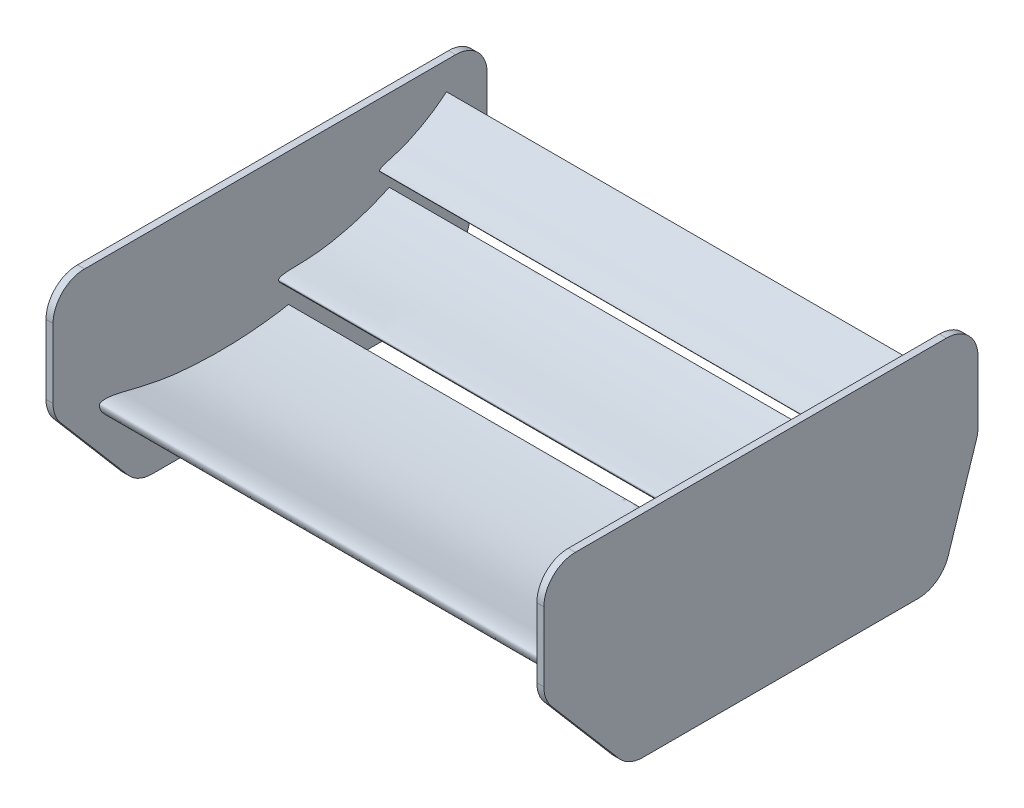
from build123d import *

# Parameters (mm, degrees)
EXTRUDED_AIRFOILS_DEPTH   = 487.449999952
EXTRUDED_AIRFOILS_2_DEPTH = 487.449999952
EXTRUDED_AIRFOILS_3_DEPTH = 487.449999952
EXTRUDED_ENDPLATE_DEPTH   = 14.200000048


with BuildPart() as part:
    # Airfoils Sketch → Extruded Airfoils (new body)
    with BuildSketch(Plane(origin=(0, 0, 0), x_dir=(0, 0, -1), z_dir=(1, 0, 0))):
        with BuildLine():
            add(Edge.make_bspline(
                [(792.439603798, 907.303291802), (792.446171081, 907.268640953), (789.682089853, 906.222334354), (787.14343716, 904.84103978), (781.389641799, 901.9239641), (774.736633883, 898.597322349), (766.183097378, 895.098479729), (756.039648025, 891.641647126), (744.265943656, 887.997719918), (731.031822052, 884.180414421), (716.523575535, 880.238338434), (700.95987565, 876.237060803), (684.557738987, 872.272309521), (667.541579637, 868.434245285), (650.131386339, 864.83621889), (632.53959645, 861.611358837), (614.975684745, 858.871428532), (597.587921503, 856.78374598), (580.457824417, 855.586248079), (563.650637288, 855.308504571), (547.226019859, 855.929399724), (531.271156892, 857.408079062), (515.877714685, 859.696840395), (501.15304031, 862.729365174), (487.202917273, 866.389194296), (474.150275032, 870.591587482), (462.117196819, 875.26177561), (451.207262735, 880.311135051), (441.512258921, 885.65102755), (433.103905877, 891.184900726), (426.042294576, 896.810376479), (420.362153479, 902.413299595), (416.0811171, 907.863991989), (413.205327734, 913.032414956), (411.811672409, 917.445296437), (411.587687822, 920.46577338), (411.818200092, 922.040378022), (412.01255513, 922.806237928), (412.207523029, 923.301301722), (412.382321348, 923.667977039), (412.534801755, 923.916187976), (412.704991729, 924.146164352), (412.915129501, 924.347486807), (413.152209092, 924.534851606), (413.510999093, 924.789777428), (414.034913369, 925.072030327), (414.870828311, 925.44116423), (415.896685237, 925.781161045), (418.59546647, 926.469892152), (423.587371889, 926.842536648), (431.449681113, 926.459382377), (441.307324477, 925.067802147), (453.214037278, 922.671568639), (467.28801474, 919.25119632), (483.628710952, 915.049329296), (502.262123688, 910.574846045), (522.977520135, 906.181321833), (545.40118948, 902.206753805), (569.035763396, 899.089476309), (593.267067222, 896.938316723), (617.538431227, 895.542126298), (641.442078996, 894.822734287), (664.614834259, 894.758673646), (686.671753534, 895.360311825), (707.235591301, 896.507587285), (725.988379628, 897.994837167), (742.709096972, 899.675118449), (757.15142712, 901.406627203), (769.34904164, 903.100156658), (778.687808405, 904.509910955), (786.263431648, 905.956734955), (789.410710987, 906.496277107), (792.432933313, 907.338487169), (792.439603798, 907.303291802)],
                knots=[0, 0, 0, 0, 0.001812691, 0.006911328, 0.014576348, 0.024172143, 0.035572242, 0.04901308, 0.064512615, 0.081849281, 0.100772139, 0.120997345, 0.142228397, 0.164173399, 0.186536734, 0.209022727, 0.231367049, 0.253319655, 0.274803883, 0.295858285, 0.316448578, 0.336530716, 0.35603337, 0.374893008, 0.392989986, 0.410197087, 0.426388181, 0.441458696, 0.455334222, 0.467938119, 0.479235883, 0.48920359, 0.497850586, 0.505193934, 0.511308341, 0.515097163, 0.516441428, 0.517272652, 0.518060388, 0.518436362, 0.518797413, 0.519153544, 0.519507976, 0.519886846, 0.520288641, 0.521160208, 0.522116283, 0.523720315, 0.52521352, 0.532574604, 0.542380648, 0.554776211, 0.56993128, 0.588004893, 0.609187965, 0.63332852, 0.660001247, 0.688743434, 0.718873444, 0.749542513, 0.780126844, 0.81020899, 0.839387288, 0.867183376, 0.893104481, 0.916760447, 0.937874173, 0.956198632, 0.971543675, 0.983762849, 0.992691516, 0.998158824, 1, 1, 1, 1], degree=3))
        make_face()
    extrude(amount=EXTRUDED_AIRFOILS_DEPTH)



with BuildPart() as body_2:
    # Airfoils Sketch → Extruded Airfoils 2 (new body)
    with BuildSketch(Plane(origin=(0, 0, 0), x_dir=(0, 0, -1), z_dir=(1, 0, 0))):
        with BuildLine():
            add(Edge.make_bspline(
                [(995.589595911, 1010.123811069), (995.598782996, 1010.104748821), (994.159326974, 1009.069117963), (992.90254006, 1007.874350102), (990.020893182, 1005.290227768), (986.681704825, 1002.329099165), (982.267796, 998.973034805), (976.925920649, 995.394417747), (970.668276232, 991.454204354), (963.591163143, 987.186718344), (955.794999746, 982.649060236), (947.396336057, 977.913188629), (938.506079496, 973.068284025), (929.2402893, 968.201449135), (919.708858745, 963.412539401), (910.014233354, 958.811699878), (900.260459485, 954.496233299), (890.507484942, 950.586134835), (880.76560419, 947.231961123), (871.068037707, 944.460981272), (861.452640715, 942.270222191), (851.976285974, 940.649545489), (842.699506931, 939.585540091), (833.694815872, 939.056440795), (825.041605312, 939.011180363), (816.824279132, 939.419736988), (809.125202344, 940.257736297), (802.018167854, 941.489901078), (795.570135585, 943.079114145), (789.837665306, 944.980555614), (784.871481509, 947.144223306), (780.709438593, 949.509350974), (777.381894632, 952.003521458), (774.912603322, 954.552323958), (773.419620057, 956.893410948), (772.820754383, 958.609162075), (772.709826434, 959.557529427), (772.703534487, 960.031569416), (772.739650042, 960.348763202), (772.784013834, 960.588416578), (772.833839662, 960.75594749), (772.896760837, 960.915660607), (772.987283686, 961.064970737), (773.095588319, 961.210375464), (773.263939242, 961.413836136), (773.523745184, 961.658776751), (773.950880952, 962.002520757), (774.492623381, 962.358874566), (775.94976284, 963.177130053), (778.784980564, 964.168298335), (783.401125658, 965.167188391), (789.330277525, 965.891497926), (796.602992886, 966.35175805), (805.29079837, 966.555030519), (815.413652591, 966.657385427), (826.907598237, 966.957783323), (839.595596739, 967.628415696), (853.208573884, 968.807136565), (867.390207559, 970.670747971), (881.767649503, 973.186945362), (896.051068305, 976.146910281), (910.016274151, 979.442014262), (923.456119884, 983.003417799), (936.145899418, 986.777350983), (947.885622567, 990.635648493), (958.522946947, 994.409739597), (967.952597299, 997.980139906), (976.053840642, 1001.226415379), (982.860044567, 1004.102094648), (988.053455412, 1006.369355916), (992.219270133, 1008.384300061), (993.9595069, 1009.18574018), (995.580264456, 1010.143172868), (995.589595911, 1010.123811069)],
                knots=[0, 0, 0, 0, 0.001812691, 0.006911328, 0.014576348, 0.024172143, 0.035572242, 0.04901308, 0.064512615, 0.081849281, 0.100772139, 0.120997345, 0.142228397, 0.164173399, 0.186536734, 0.209022727, 0.231367049, 0.253319655, 0.274803883, 0.295858285, 0.316448578, 0.336530716, 0.35603337, 0.374893008, 0.392989986, 0.410197087, 0.426388181, 0.441458696, 0.455334222, 0.467938119, 0.479235883, 0.48920359, 0.497850586, 0.505193934, 0.511308341, 0.515097163, 0.516441428, 0.517272652, 0.518060388, 0.518436362, 0.518797413, 0.519153544, 0.519507976, 0.519886846, 0.520288641, 0.521160208, 0.522116283, 0.523720315, 0.52521352, 0.532574604, 0.542380648, 0.554776211, 0.56993128, 0.588004893, 0.609187965, 0.63332852, 0.660001247, 0.688743434, 0.718873444, 0.749542513, 0.780126844, 0.81020899, 0.839387288, 0.867183376, 0.893104481, 0.916760447, 0.937874173, 0.956198632, 0.971543675, 0.983762849, 0.992691516, 0.998158824, 1, 1, 1, 1], degree=3))
        make_face()
    extrude(amount=EXTRUDED_AIRFOILS_2_DEPTH)


with BuildPart() as body_3:
    # Airfoils Sketch → Extruded Airfoils 3 (new body)
    with BuildSketch(Plane(origin=(0, 0, 0), x_dir=(0, 0, -1), z_dir=(1, 0, 0))):
        with BuildLine():
            add(Edge.make_bspline(
                [(1110.922579847, 1119.147466215), (1110.931784991, 1119.136776265), (1110.183540486, 1118.221508781), (1109.580384311, 1117.235283766), (1108.170626267, 1115.074020036), (1106.53128507, 1112.591035947), (1104.268021632, 1109.668294009), (1101.445594224, 1106.442122198), (1098.095848834, 1102.825087912), (1094.274875731, 1098.855910177), (1090.037486909, 1094.588685694), (1085.446318644, 1090.089862487), (1080.55740209, 1085.436005022), (1075.430444429, 1080.7032287), (1070.118981835, 1075.974797136), (1064.669979069, 1071.339314867), (1059.133647639, 1066.877392826), (1053.527886277, 1062.676645728), (1047.833346159, 1058.835800869), (1042.066714452, 1055.37815027), (1036.252881045, 1052.308311174), (1030.430218521, 1049.629568129), (1024.640021453, 1047.343729871), (1018.932739668, 1045.449292394), (1013.368309469, 1043.927069784), (1008.006262925, 1042.772293038), (1002.903844733, 1041.98347802), (998.114660816, 1041.550640622), (993.688234479, 1041.461432883), (989.668720908, 1041.696752175), (986.097411846, 1042.233151878), (983.009168628, 1043.038033161), (980.436035646, 1044.070001117), (978.406148394, 1045.285237479), (977.040795731, 1046.535173401), (976.359109806, 1047.536700389), (976.12404067, 1048.128261891), (976.038195249, 1048.432434552), (976.006721352, 1048.642923261), (975.993938202, 1048.80490298), (975.997116777, 1048.921381853), (976.010077038, 1049.035086001), (976.042606407, 1049.1468537), (976.087260226, 1049.259174688), (976.160563564, 1049.419241584), (976.285602213, 1049.621799711), (976.501344863, 1049.916854434), (976.788712763, 1050.239804171), (977.585851785, 1051.018143872), (979.240569648, 1052.145612796), (982.04078431, 1053.585346108), (985.733888186, 1055.074817248), (990.337741192, 1056.626080172), (995.897184462, 1058.256023937), (1002.39814108, 1060.068593745), (1009.747841246, 1062.245269826), (1017.802569918, 1064.866387684), (1026.365270443, 1067.9742908), (1035.17598251, 1071.621348982), (1044.000184299, 1075.722426208), (1052.687269509, 1080.093044459), (1061.111614396, 1084.62456931), (1069.151704417, 1089.236929105), (1076.67211775, 1093.856726539), (1083.56618502, 1098.36692197), (1089.764891477, 1102.632678107), (1095.221061616, 1106.558888086), (1099.877729785, 1110.047166343), (1103.76440151, 1113.073345059), (1106.717494353, 1115.429451626), (1109.052402425, 1117.44577081), (1110.034743538, 1118.262129562), (1110.91323005, 1119.15832415), (1110.922579847, 1119.147466215)],
                knots=[0, 0, 0, 0, 0.001812691, 0.006911328, 0.014576348, 0.024172143, 0.035572242, 0.04901308, 0.064512615, 0.081849281, 0.100772139, 0.120997345, 0.142228397, 0.164173399, 0.186536734, 0.209022727, 0.231367049, 0.253319655, 0.274803883, 0.295858285, 0.316448578, 0.336530716, 0.35603337, 0.374893008, 0.392989986, 0.410197087, 0.426388181, 0.441458696, 0.455334222, 0.467938119, 0.479235883, 0.48920359, 0.497850586, 0.505193934, 0.511308341, 0.515097163, 0.516441428, 0.517272652, 0.518060388, 0.518436362, 0.518797413, 0.519153544, 0.519507976, 0.519886846, 0.520288641, 0.521160208, 0.522116283, 0.523720315, 0.52521352, 0.532574604, 0.542380648, 0.554776211, 0.56993128, 0.588004893, 0.609187965, 0.63332852, 0.660001247, 0.688743434, 0.718873444, 0.749542513, 0.780126844, 0.81020899, 0.839387288, 0.867183376, 0.893104481, 0.916760447, 0.937874173, 0.956198632, 0.971543675, 0.983762849, 0.992691516, 0.998158824, 1, 1, 1, 1], degree=3))
        make_face()
    extrude(amount=EXTRUDED_AIRFOILS_3_DEPTH)


with BuildPart() as part_1:
    add(part.part)

    add(body_2.part)  # Extruded Endplate merges body 2

    add(body_3.part)  # Extruded Endplate merges body 3
    # Endplate Sketch → Extruded Endplate (add)
    with BuildSketch(Plane(origin=(501.65, 0, 0), x_dir=(0, 0, -1), z_dir=(1, 0, 0))):
        with BuildLine():
            Line((381.65288186, 1174.600000046), (1129.475, 1174.600000046))
            ThreePointArc((1129.475, 1174.600000046), (1174.376280605, 1156.001280651), (1192.975, 1111.100000046))
            Line((1192.975, 1111.100000046), (1192.975, 986.671665425))
            ThreePointArc((1192.975, 986.671665425), (1192.187961727, 976.704999408), (1189.846356489, 966.985393159))
            Line((1189.846356489, 966.985393159), (1132.89690026, 792.340042461))
            ThreePointArc((1132.89690026, 792.340042461), (1109.822807151, 760.634057096), (1072.525543772, 748.526314727))
            Line((1072.525543772, 748.526314727), (517.768114628, 748.526314727))
            ThreePointArc((517.768114628, 748.526314727), (491.175616957, 754.362729445), (469.471460854, 770.799099999))
            Line((469.471460854, 770.799099999), (333.356228086, 930.25470023))
            ThreePointArc((333.356228086, 930.25470023), (322.074834248, 949.511338209), (318.15288186, 971.481914958))
            Line((318.15288186, 971.481914958), (318.15288186, 1111.100000046))
            ThreePointArc((318.15288186, 1111.100000046), (336.751601255, 1156.001280651), (381.65288186, 1174.600000046))
        make_face()
    extrude(amount=-EXTRUDED_ENDPLATE_DEPTH)

    # Mirror 2: part across plane


with BuildPart() as part_2:
    add(part_1.part)
    add(part_1.part.mirror(Plane(origin=(0, 0, 0), x_dir=(0, 0, 1), z_dir=(1, 0, 0))))


solid = part_2.part
